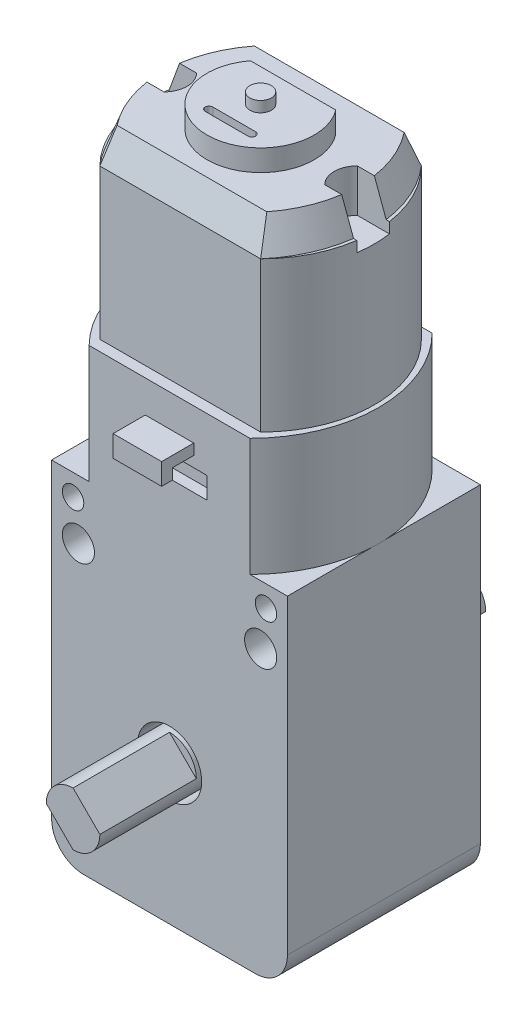
from build123d import *

# Parameters (mm, degrees)
EXTRUDE_1_DEPTH      = 18
EXTRUDE_2_DEPTH      = 11
SKETCH_3_R           = 1
SKETCH_3_R_2         = 1.5
CUT_EXTRUDE_1_DEPTH  = 31
SKETCH_4_R           = 3
CUT_EXTRUDE_2_DEPTH  = 7
CUT_EXTRUDE_START    = -7
SKETCH_5_R           = 3
CUT_EXTRUDE_3_DEPTH  = 7
SKETCH_6_R           = 2.5
EXTRUDE_3_DEPTH      = 16
CUT_EXTRUDE_START_2  = -9
CUT_EXTRUDE_4_DEPTH  = 9
EXTRUDE_START        = 16
SKETCH_8_R           = 2.5
EXTRUDE_4_DEPTH      = 16
CUT_EXTRUDE_5_DEPTH  = 9
EXTRUDE_5_DEPTH      = 5
SKETCH_11_R          = 1
CUT_EXTRUDE_6_DEPTH  = 14
SKETCH_12_R          = 2
EXTRUDE_6_DEPTH      = 2
SKETCH_13_R          = 2
CUT_EXTRUDE_7_DEPTH  = 5
EXTRUDE_START_2      = 3
SKETCH_14_R          = 1.4
EXTRUDE_8_DEPTH      = 3
CUT_EXTRUDE_8_DEPTH  = 22
CUT_EXTRUDE_9_DEPTH  = 11
SKETCH_18_W          = 4.5245364
SKETCH_18_H          = 2
EXTRUDE_9_DEPTH      = 3
SKETCH_19_W          = 2
SKETCH_19_H          = 1
CUT_EXTRUDE_10_DEPTH = 8
SKETCH_20_W          = 2
SKETCH_20_H          = 1
CUT_EXTRUDE_11_DEPTH = 8
EXTRUDE_START_3      = 25
EXTRUDE_10_DEPTH     = 25
CUT_EXTRUDE_13_DEPTH = 1
EXTRUDE_11_DEPTH     = 3
EXTRUDE_11_DRAFT     = 20
SKETCH_25_R          = 5
EXTRUDE_12_DEPTH     = 2
CUT_EXTRUDE_START_3  = -2
CUT_EXTRUDE_14_DEPTH = 2
CUT_EXTRUDE_START_4  = -14
CUT_EXTRUDE_15_DEPTH = 14
CUT_EXTRUDE_16_DEPTH = 14
SKETCH_32_R          = 1
EXTRUDE_13_DEPTH     = 1


with BuildPart() as part:
    # 草图1 → 凸台-拉伸1 (new body)
    with BuildSketch(Plane.XY):
        with BuildLine():
            Line((0, 0), (-8, 0))
            ThreePointArc((-8, 0), (-10.121320344, 0.878679656), (-11, 3))
            Line((-11, 3), (-11, 32))
            Line((-11, 32), (11, 32))
            Line((11, 32), (11, 3))
            ThreePointArc((11, 3), (10.121320344, 0.878679656), (8, 0))
            Line((8, 0), (0, 0))
        make_face()
    extrude(amount=EXTRUDE_1_DEPTH)

    # 草图2 → 凸台-拉伸2 (add)
    with BuildSketch(Plane(origin=(0, 32, 0), x_dir=(1, 0, 0), z_dir=(0, 1, 0))):
        with BuildLine():
            Line((7.5, -18), (-7.5, -18))
            ThreePointArc((-7.5, -18), (-11.02081528, -9.5), (-7.5, -1))
            Line((-7.5, -1), (0, -1))
            Line((0, -1), (7.5, -1))
            ThreePointArc((7.5, -1), (11.02081528, -9.5), (7.5, -18))
        make_face()
    extrude(amount=EXTRUDE_2_DEPTH)

    # 草图3 → 切除-拉伸1 (cut)
    with BuildSketch(Plane.XY.offset(18)):
        with Locations((9, 30)):
            Circle(SKETCH_3_R)
        with Locations((8.5, 26.5)):
            Circle(SKETCH_3_R_2)
        with Locations((-8.5, 26.5)):
            Circle(SKETCH_3_R_2)
        with Locations((-9, 30)):
            Circle(SKETCH_3_R)
    extrude(amount=-CUT_EXTRUDE_1_DEPTH, mode=Mode.SUBTRACT)

    # 草图4 → 切除-拉伸2 (cut)
    with BuildSketch(Plane.XY.offset(18)):
        with Locations((0, 13)):
            Circle(SKETCH_4_R)
    extrude(amount=-CUT_EXTRUDE_2_DEPTH, mode=Mode.SUBTRACT)

    # 草图5 → 切除-拉伸3 (cut)
    with BuildSketch(Plane(origin=(0, 0, 0), x_dir=(-1, 0, 0), z_dir=(0, 0, -1)).offset(CUT_EXTRUDE_START)):
        with Locations(Location((0, 13, 0), (0, 0, 180))):
            Circle(SKETCH_5_R)
    extrude(amount=CUT_EXTRUDE_3_DEPTH, mode=Mode.SUBTRACT)

    # 草图6 → 凸台-拉伸3 (add)
    with BuildSketch(Plane.XY.offset(11)):
        with Locations((0, 13)):
            Circle(SKETCH_6_R)
    extrude(amount=EXTRUDE_3_DEPTH)

    # 草图7 → 切除-拉伸4 (cut)
    with BuildSketch(Plane.XY.offset(27).offset(CUT_EXTRUDE_START_2)):
        with BuildLine():
            Line((0, 15.5), (2.5, 13))
            ThreePointArc((2.5, 13), (1.767766953, 14.767766953), (0, 15.5))
        make_face()
        with BuildLine():
            Line((-2.5, 13), (0, 10.5))
            ThreePointArc((0, 10.5), (-1.767766953, 11.232233047), (-2.5, 13))
        make_face()
    extrude(amount=CUT_EXTRUDE_4_DEPTH, mode=Mode.SUBTRACT)

    # 草图8 → 凸台-拉伸4 (add)
    with BuildSketch(Plane(origin=(0, 0, 7), x_dir=(-1, 0, 0), z_dir=(0, 0, -1)).offset(EXTRUDE_START)):
        with Locations(Location((0, 13, 0), (0, 0, 180))):
            Circle(SKETCH_8_R)
    extrude(amount=-EXTRUDE_4_DEPTH)

    # 草图9 → 切除-拉伸5 (cut)
    with BuildSketch(Plane(origin=(0, 0, -9), x_dir=(-1, 0, 0), z_dir=(0, 0, -1))):
        with BuildLine():
            Line((0, 15.5), (2.5, 13))
            ThreePointArc((2.5, 13), (1.767766953, 14.767766953), (0, 15.5))
        make_face()
        with BuildLine():
            Line((-2.5, 13), (0, 10.5))
            ThreePointArc((0, 10.5), (-1.767766953, 11.232233047), (-2.5, 13))
        make_face()
    extrude(amount=-CUT_EXTRUDE_5_DEPTH, mode=Mode.SUBTRACT)

    # 草图10 → 凸台-拉伸5 (add)
    with BuildSketch(Plane.XZ):
        Polygon((-2.5, 9), (-2.5, 10.5), (2.5, 10.5), (2.5, 7.5), (-2.5, 7.5), align=None)
    extrude(amount=EXTRUDE_5_DEPTH)

    # 草图11 → 切除-拉伸6 (cut)
    with BuildSketch(Plane.XY.offset(10.5)):
        with Locations((0, -2.5)):
            Circle(SKETCH_11_R)
    extrude(amount=-CUT_EXTRUDE_6_DEPTH, mode=Mode.SUBTRACT)

    # 草图12 → 凸台-拉伸6 (add)
    with BuildSketch(Plane(origin=(0, 0, 0), x_dir=(-1, 0, 0), z_dir=(0, 0, -1))):
        with Locations(Location((0, 22, 0), (0, 0, 180))):
            Circle(SKETCH_12_R)
    extrude(amount=EXTRUDE_6_DEPTH)

    # 草图13 → 切除-拉伸7 (cut)
    with BuildSketch(Plane(origin=(0, 0, 0), x_dir=(-1, 0, 0), z_dir=(0, 0, -1))):
        with Locations((-6.646802627, 28.881218783)):
            Circle(SKETCH_13_R)
        with Locations((6.646802627, 28.881218783)):
            Circle(SKETCH_13_R)
    extrude(amount=-CUT_EXTRUDE_7_DEPTH, mode=Mode.SUBTRACT)

    # 草图14 → 凸台-拉伸8 (add)
    # profile 1 of 2: a face of its own
    with BuildSketch(Plane(origin=(0, 0, 5), x_dir=(-1, 0, 0), z_dir=(0, 0, -1)).offset(EXTRUDE_START_2)):
        with BuildLine():
            ThreePointArc((-8.638081379, 29.067790307), (-8.61386249, 28.519728121), (-8.441642649, 27.998864377))
            ThreePointArc((-8.441642649, 27.998864377), (-7.578736532, 27.683754038), (-7.061366244, 26.924656234))
            ThreePointArc((-7.061366244, 26.924656234), (-4.726868568, 29.441444815), (-8.048546627, 30.307792916))
            ThreePointArc((-8.048546627, 30.307792916), (-8.096873145, 29.570626173), (-8.638081379, 29.067790307))
        make_face()
        with Locations((-6.646802627, 28.881218783)):
            Circle(SKETCH_14_R, mode=Mode.SUBTRACT)
    # profile 2 of 2: a face of its own
    with BuildSketch(Plane(origin=(0, 0, 5), x_dir=(-1, 0, 0), z_dir=(0, 0, -1)).offset(EXTRUDE_START_2)):
        with BuildLine():
            ThreePointArc((7.061366244, 26.924656234), (4.726868568, 29.441444815), (8.048546627, 30.307792916))
            ThreePointArc((8.048546627, 30.307792916), (8.096873145, 29.570626173), (8.638081379, 29.067790307))
            ThreePointArc((8.638081379, 29.067790307), (8.61386249, 28.519728121), (8.441642649, 27.998864377))
            ThreePointArc((8.441642649, 27.998864377), (7.578736532, 27.683754038), (7.061366244, 26.924656234))
        make_face()
        with Locations(Location((6.646802627, 28.881218783, 0), (0, 0, 180))):
            Circle(SKETCH_14_R, mode=Mode.SUBTRACT)
    extrude(amount=-EXTRUDE_8_DEPTH)

    # 草图16 → 切除-拉伸8 (cut)
    with BuildSketch(Plane(origin=(0, 0, 1), x_dir=(-1, 0, 0), z_dir=(0, 0, -1))):
        Polygon((0, 36), (3.5, 36), (3.5, 38), (-3.5, 38), (-3.5, 36), align=None)
    extrude(amount=-CUT_EXTRUDE_8_DEPTH, mode=Mode.SUBTRACT)

    # 草图17 → 切除-拉伸9 (cut)
    with BuildSketch(Plane(origin=(0, 43, 0), x_dir=(1, 0, 0), z_dir=(0, 1, 0))):
        with BuildLine():
            Line((7.5, -2), (-7.5, -2))
            ThreePointArc((-7.5, -2), (-10.606601718, -9.5), (-7.5, -17))
            Line((-7.5, -17), (7.5, -17))
            ThreePointArc((7.5, -17), (10.606601718, -9.5), (7.5, -2))
        make_face()
    extrude(amount=-CUT_EXTRUDE_9_DEPTH, mode=Mode.SUBTRACT)

    # 草图18 → 凸台-拉伸9 (add)
    with BuildSketch(Plane(origin=(0, 0, 1), x_dir=(-1, 0, 0), z_dir=(0, 0, -1))):
        with Locations((0, 39)):
            Rectangle(SKETCH_18_W, SKETCH_18_H)
    extrude_9 = extrude(amount=EXTRUDE_9_DEPTH)

    # 草图19 → 切除-拉伸10 (cut)
    with BuildSketch(Plane(origin=(2.2622682, 0, 0), x_dir=(0, 0, -1), z_dir=(1, 0, 0))):
        with Locations((0, 38.5)):
            Rectangle(SKETCH_19_W, SKETCH_19_H)
    extrude(amount=-CUT_EXTRUDE_10_DEPTH, mode=Mode.SUBTRACT)

    # 镜向2: 凸台-拉伸9 across plane
    add(extrude_9.mirror(Plane.XY.offset(9.5)))

    # 草图20 → 切除-拉伸11 (cut)
    with BuildSketch(Plane.ZY.offset(2.2622682)):
        with Locations((19, 38.5)):
            Rectangle(SKETCH_20_W, SKETCH_20_H)
    extrude(amount=-CUT_EXTRUDE_11_DEPTH, mode=Mode.SUBTRACT)

    # 草图21 → 凸台-拉伸10 (add)
    with BuildSketch(Plane(origin=(0, 32, 0), x_dir=(1, 0, 0), z_dir=(0, 1, 0)).offset(EXTRUDE_START_3)):
        with BuildLine():
            Line((7.5, -2), (-7.5, -2))
            ThreePointArc((-7.5, -2), (-10.606601718, -9.5), (-7.5, -17))
            Line((-7.5, -17), (7.5, -17))
            ThreePointArc((7.5, -17), (10.606601718, -9.5), (7.5, -2))
        make_face()
    extrude(amount=-EXTRUDE_10_DEPTH)

    # 草图23 → 切除-拉伸13 (cut)
    with BuildSketch(Plane(origin=(0, 57, 0), x_dir=(1, 0, 0), z_dir=(0, 1, 0))):
        with BuildLine():
            Line((-10.496934744, -7.978697601), (-7.496934744, -7.978697601))
            ThreePointArc((-7.496934744, -7.978697601), (-6.866790657, -9.5), (-7.496934744, -11.021302399))
            Line((-7.496934744, -11.021302399), (-10.496934744, -11.021302399))
            ThreePointArc((-10.496934744, -11.021302399), (-10.606601718, -9.5), (-10.496934744, -7.978697601))
        make_face()
        with BuildLine():
            Line((7.496934744, -11.021302399), (10.496934744, -11.021302399))
            ThreePointArc((10.496934744, -11.021302399), (10.606601718, -9.5), (10.496934744, -7.978697601))
            Line((10.496934744, -7.978697601), (7.496934744, -7.978697601))
            ThreePointArc((7.496934744, -7.978697601), (6.866790657, -9.5), (7.496934744, -11.021302399))
        make_face()
    extrude(amount=-CUT_EXTRUDE_13_DEPTH, mode=Mode.SUBTRACT)


with BuildPart() as extrude_11_tool:
    # 草图24 → 凸台-拉伸11 (with draft: the straight prism first)
    with BuildSketch(Plane(origin=(0, 57, 0), x_dir=(1, 0, 0), z_dir=(0, 1, 0))):
        with BuildLine():
            Line((7.5, -2), (-7.5, -2))
            ThreePointArc((-7.5, -2), (-10.289850602, -9.5), (-7.5, -17))
            Line((-7.5, -17), (7.5, -17))
            ThreePointArc((7.5, -17), (10.289850602, -9.5), (7.5, -2))
        make_face()
    extrude(amount=EXTRUDE_11_DEPTH)
    # 凸台-拉伸11: the draft: its side faces are tilted about the plane it starts from
    extrude_11_sides = [extrude_11_tool.faces().sort_by_distance(p)[0] for p in [
        (0, 58.5, 2),
        (-10.289850602, 58.5, 9.5),
        (0, 58.5, 17),
        (10.289850602, 58.5, 9.5),
    ]]
    draft(extrude_11_sides, Plane(origin=(0, 57, 0), x_dir=(1, 0, 0), z_dir=(0, 1, 0)), EXTRUDE_11_DRAFT)


with BuildPart() as part_1:
    add(part.part)

    # 凸台-拉伸11: add extrude_11_tool
    add(extrude_11_tool.part)

    # 草图25 → 凸台-拉伸12 (add)
    with BuildSketch(Plane(origin=(0, 60, 0), x_dir=(1, 0, 0), z_dir=(0, 1, 0))):
        with Locations(Location((0, -9.5, 0), (0, 0, 90))):
            Circle(SKETCH_25_R)
    extrude(amount=EXTRUDE_12_DEPTH)

    # 草图26 → 切除-拉伸14 (cut)
    with BuildSketch(Plane(origin=(0, 62, 0), x_dir=(1, 0, 0), z_dir=(0, 1, 0)).offset(CUT_EXTRUDE_START_3)):
        with BuildLine():
            Line((3.977952818, -6.470826618), (-3.977952818, -6.470826618))
            ThreePointArc((-3.977952818, -6.470826618), (0, -4.5), (3.977952818, -6.470826618))
        make_face()
    extrude(amount=CUT_EXTRUDE_14_DEPTH, mode=Mode.SUBTRACT)

    # 草图30 → 切除-拉伸15 (cut)
    with BuildSketch(Plane.XZ.offset(-57).offset(CUT_EXTRUDE_START_4)):
        with BuildLine():
            Line((7.496934744, 7.978697601), (10.496934744, 7.978697601))
            Line((10.496934744, 7.978697601), (10.496934744, 11.021302399))
            Line((10.496934744, 11.021302399), (7.496934744, 11.021302399))
            ThreePointArc((7.496934744, 11.021302399), (6.866790657, 9.5), (7.496934744, 7.978697601))
        make_face()
        with BuildLine():
            Line((-10.496934744, 11.021302399), (-7.496934744, 11.021302399))
            ThreePointArc((-7.496934744, 11.021302399), (-6.866790657, 9.5), (-7.496934744, 7.978697601))
            Line((-7.496934744, 7.978697601), (-10.496934744, 7.978697601))
            Line((-10.496934744, 7.978697601), (-10.496934744, 11.021302399))
        make_face()
    extrude(amount=CUT_EXTRUDE_15_DEPTH, mode=Mode.SUBTRACT)

    # 草图31 → 切除-拉伸16 (cut)
    with BuildSketch(Plane(origin=(0, 62, 0), x_dir=(1, 0, 0), z_dir=(0, 1, 0))):
        with BuildLine():
            Line((2, -12.67407861), (-2, -12.67407861))
            ThreePointArc((-2, -12.67407861), (-2.354738624, -12.319339986), (-2, -11.964601361))
            Line((-2, -11.964601361), (2, -11.964601361))
            ThreePointArc((2, -11.964601361), (2.354738624, -12.319339986), (2, -12.67407861))
        make_face()
    extrude(amount=-CUT_EXTRUDE_16_DEPTH, mode=Mode.SUBTRACT)

    # 草图32 → 凸台-拉伸13 (add)
    with BuildSketch(Plane(origin=(0, 62, 0), x_dir=(1, 0, 0), z_dir=(0, 1, 0))):
        with Locations(Location((0, -9.5, 0), (0, 0, 270))):
            Circle(SKETCH_32_R)
    extrude(amount=EXTRUDE_13_DEPTH)


solid = part_1.part
